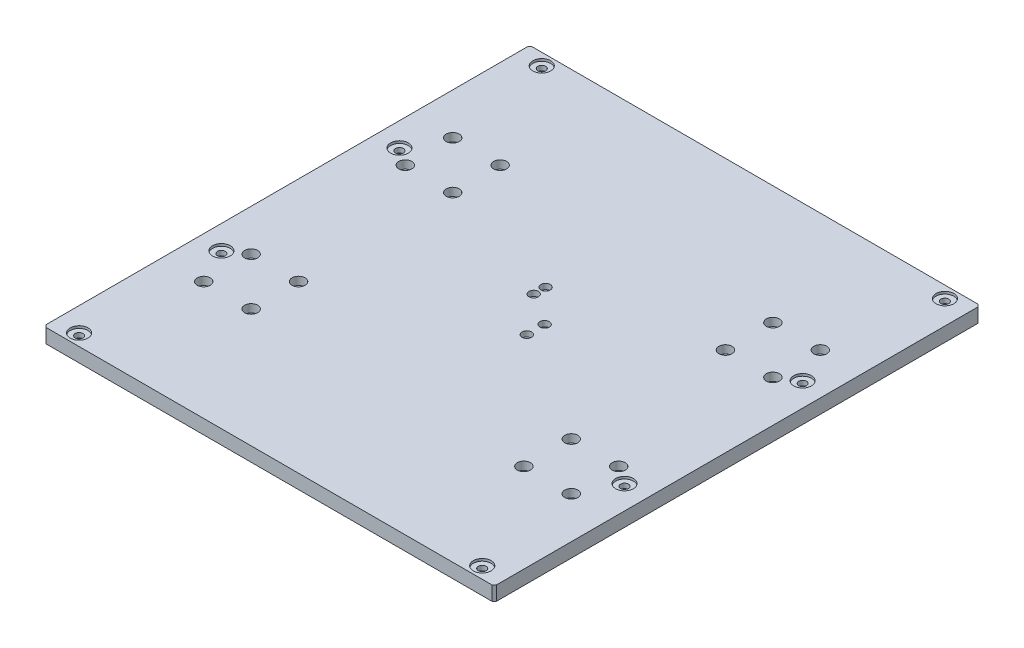
from build123d import *

# Parameters (mm, degrees)
SKETCH_1_W                  = 380
SKETCH_1_H                  = 410
EXTRUDE_1_DEPTH             = 12
HOLE_WIZARD_3_D             = 6.6
HOLE_WIZARD_3_CBORE_D       = 11
HOLE_WIZARD_3_CBORE_DEPTH   = 6.8
HOLE_WIZARD_3_2_D           = 4.5
HOLE_WIZARD_3_2_CBORE_D     = 8
HOLE_WIZARD_3_2_CBORE_DEPTH = 4.6
HOLE_WIZARD_3_3_D           = 6.6
HOLE_WIZARD_3_3_CBORE_D     = 11
HOLE_WIZARD_3_3_CBORE_DEPTH = 6
HOLE_WIZARD_1_D             = 15
HOLE_WIZARD_1_DEPTH         = 2
CHAMFER_1_SIZE              = 2


with BuildPart() as part:
    # 草图1 → 凸台-拉伸1 (new body)
    with BuildSketch(Plane(origin=(0, 0, 0), x_dir=(1, 0, 0), z_dir=(0, 1, 0))):
        Rectangle(SKETCH_1_W, SKETCH_1_H)
    extrude(amount=EXTRUDE_1_DEPTH)

    # Hole Wizard 3 (through all)
    with Locations(Plane(origin=(0, 12, 0), x_dir=(1, 0, 0), z_dir=(0, 1, 0))):
        with Locations((-115, 65), (-115, 105), (-155, 105), (-155, 65), (155, 65), (155, 105), (115, 105), (115, 65), (115, -65), (115, -105), (155, -105), (155, -65), (-155, -65), (-155, -105), (-115, -105), (-115, -65)):
            CounterBoreHole(HOLE_WIZARD_3_D / 2, HOLE_WIZARD_3_CBORE_D / 2, HOLE_WIZARD_3_CBORE_DEPTH)

    # Hole Wizard 3 2 (through all)
    with Locations(Plane(origin=(0, 12, 0), x_dir=(1, 0, 0), z_dir=(0, 1, 0))):
        with Locations((20, 7.5), (20, -7.5), (-6.7, 25), (-6.7, 35)):
            CounterBoreHole(HOLE_WIZARD_3_2_D / 2, HOLE_WIZARD_3_2_CBORE_D / 2, HOLE_WIZARD_3_2_CBORE_DEPTH)

    # Hole Wizard 3 3 (through all)
    with Locations(Plane(origin=(-174.714463093, 0, 28.629345755), x_dir=(1, 0, 0), z_dir=(0, -1, 0))):
        with Locations((4.714463093, -223.729345755), (4.714463093, -103.729345755), (344.714463093, -103.729345755), (344.714463093, -223.729345755), (344.714463093, 166.470654245), (344.714463093, 46.470654245), (4.714463093, 46.470654245), (4.714463093, 166.470654245)):
            CounterBoreHole(HOLE_WIZARD_3_3_D / 2, HOLE_WIZARD_3_3_CBORE_D / 2, HOLE_WIZARD_3_3_CBORE_DEPTH)

    # 孔1
    with Locations(Plane(origin=(0, 12, 0), x_dir=(1, 0, 0), z_dir=(0, 1, 0))):
        with Locations((-170, 75.1), (-170, 195.1), (170, 195.1), (170, 75.1), (170, -75.1), (170, -195.1), (-170, -195.1), (-170, -75.1)):
            Hole(HOLE_WIZARD_1_D / 2, depth=HOLE_WIZARD_1_DEPTH)

    # 倒角1
    chamfer_1_edges = [part.edges().sort_by_distance(p)[0] for p in [
        (190, 6, 205),
        (-190, 6, 205),
        (-190, 6, -205),
        (190, 6, -205),
    ]]
    chamfer(chamfer_1_edges, length=CHAMFER_1_SIZE)


solid = part.part
